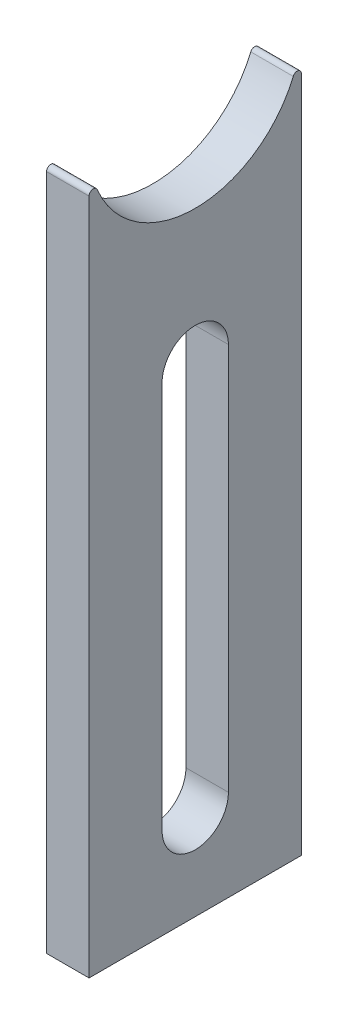
from build123d import *

# Parameters (mm, degrees)
BOSS_EXTRUDE1_DEPTH = 2.54
FILLET1_R           = 0.254
CUT_EXTRUDE1_DEPTH  = 2.54


with BuildPart() as part:
    # Sketch1 → Boss-Extrude1 (new body)
    with BuildSketch(Plane(origin=(0, 0, 0), x_dir=(0, 0, -1), z_dir=(1, 0, 0))):
        with BuildLine():
            ThreePointArc((6.35, 0), (0, -6.35), (-6.35, 0))
            Line((-6.35, 0), (-6.35, -43.036593364))
            Line((-6.35, -43.036593364), (6.35, -43.036593364))
            Line((6.35, -43.036593364), (6.35, 0))
        make_face()
    extrude(amount=BOSS_EXTRUDE1_DEPTH)

    # Fillet1
    fillet1_edges = [part.edges().sort_by_distance(p)[0] for p in [
        (1.27, 0, -6.35),
        (1.27, 0, 6.35),
    ]]
    fillet(fillet1_edges, radius=FILLET1_R)

    # Sketch2 → Cut-Extrude1 (cut)
    with BuildSketch(Plane.ZY):
        with BuildLine():
            Line((1.984375, -14.393108905), (1.984375, -37.585187193))
            ThreePointArc((1.984375, -37.585187193), (0, -39.569562193), (-1.984375, -37.585187193))
            Line((-1.984375, -37.585187193), (-1.984375, -14.393108905))
            ThreePointArc((-1.984375, -14.393108905), (0, -12.408733905), (1.984375, -14.393108905))
        make_face()
    extrude(amount=-CUT_EXTRUDE1_DEPTH, mode=Mode.SUBTRACT)


solid = part.part
